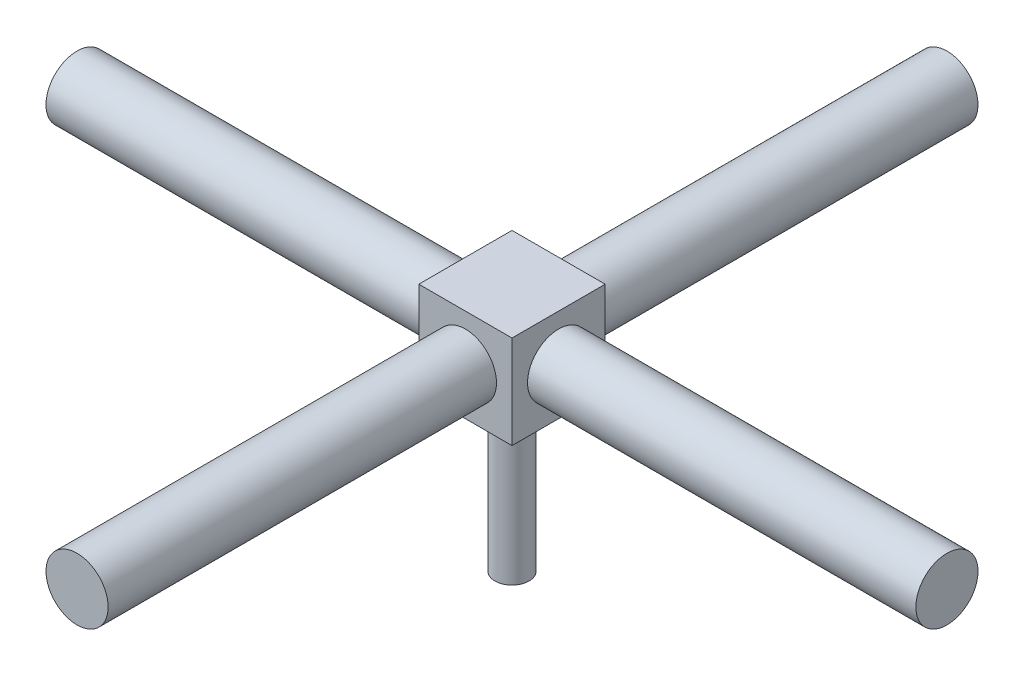
from build123d import *

# Parameters (mm, degrees)
SKETCH1_W           = 60
SKETCH1_H           = 60
BOSS_EXTRUDE1_DEPTH = 60
SKETCH2_R           = 20
BOSS_EXTRUDE2_DEPTH = 250
SKETCH3_R           = 20
BOSS_EXTRUDE3_DEPTH = 250
BOSS_EXTRUDE4_START = 250
SKETCH4_R           = 20
BOSS_EXTRUDE4_DEPTH = 250
BOSS_EXTRUDE5_START = 250
SKETCH5_R           = 20
BOSS_EXTRUDE5_DEPTH = 250
SKETCH6_R           = 11
BOSS_EXTRUDE6_DEPTH = 100


with BuildPart() as part:
    # Sketch1 → Boss-Extrude1 (new body)
    with BuildSketch(Plane(origin=(0, 0, 0), x_dir=(1, 0, 0), z_dir=(0, 1, 0))):
        Rectangle(SKETCH1_W, SKETCH1_H)
    extrude(amount=BOSS_EXTRUDE1_DEPTH)

    # Sketch2 → Boss-Extrude2 (add)
    with BuildSketch(Plane.XY.offset(30)):
        with Locations((0, 30)):
            Circle(SKETCH2_R)
    extrude(amount=BOSS_EXTRUDE2_DEPTH)

    # Sketch3 → Boss-Extrude3 (add)
    with BuildSketch(Plane.ZY.offset(30)):
        with Locations((0, 30)):
            Circle(SKETCH3_R)
    extrude(amount=BOSS_EXTRUDE3_DEPTH)

    # Sketch4 → Boss-Extrude4 (add)
    with BuildSketch(Plane(origin=(0, 0, -30), x_dir=(-1, 0, 0), z_dir=(0, 0, -1)).offset(BOSS_EXTRUDE4_START)):
        with Locations(Location((0, 30, 0), (0, 0, 180))):
            Circle(SKETCH4_R)
    extrude(amount=-BOSS_EXTRUDE4_DEPTH)

    # Sketch5 → Boss-Extrude5 (add)
    with BuildSketch(Plane(origin=(30, 0, 0), x_dir=(0, 0, -1), z_dir=(1, 0, 0)).offset(BOSS_EXTRUDE5_START)):
        with Locations(Location((0, 30, 0), (0, 0, 180))):
            Circle(SKETCH5_R)
    extrude(amount=-BOSS_EXTRUDE5_DEPTH)

    # Sketch6 → Boss-Extrude6 (add)
    with BuildSketch(Plane.XZ):
        with Locations(Location((0, 0, 0), (0, 0, 270))):
            Circle(SKETCH6_R)
    extrude(amount=BOSS_EXTRUDE6_DEPTH)


solid = part.part
